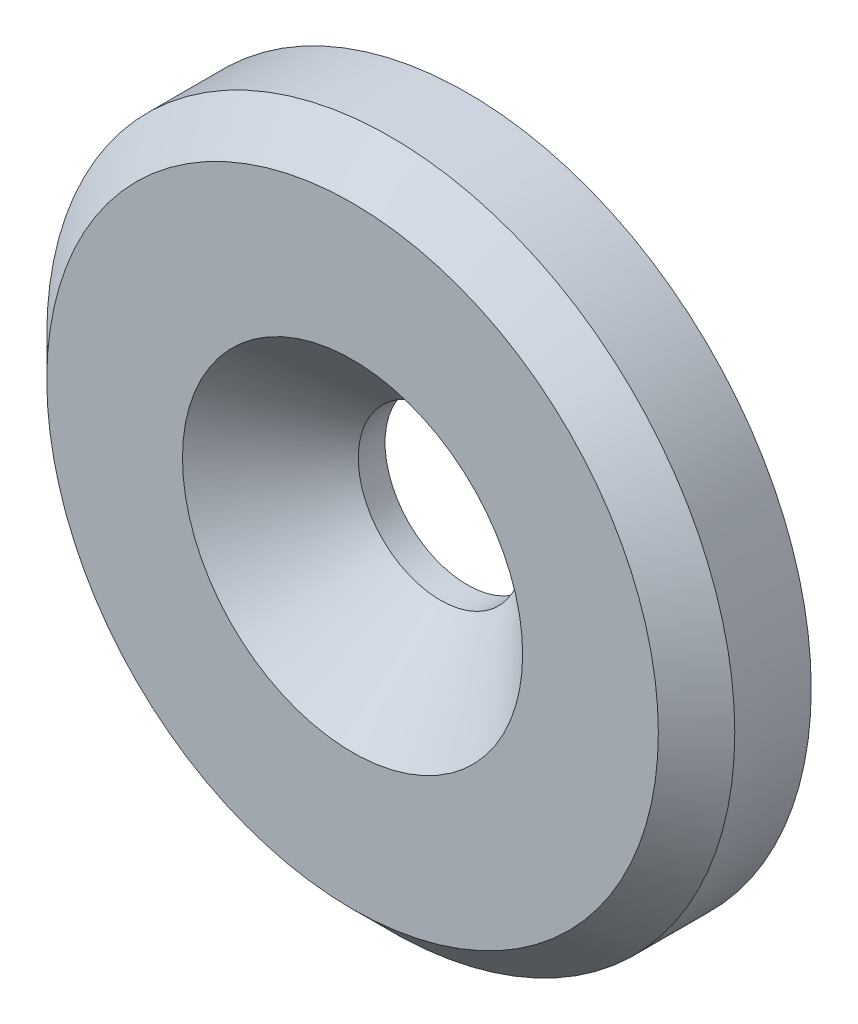
from build123d import *


with BuildPart() as part:
    # Эскиз1 → Повернуть1 (revolve)
    with BuildSketch(Plane(origin=(0, 0, 0), x_dir=(1, 0, 0), z_dir=(0, 1, 0))):
        Polygon((9, -2), (9, 0), (2.15, 0), (2.15, -0.7), (4.45, -3), (8, -3), align=None)
    revolve(axis=Axis((0, 0, -0.005), (0, 0, 1)))


solid = part.part
